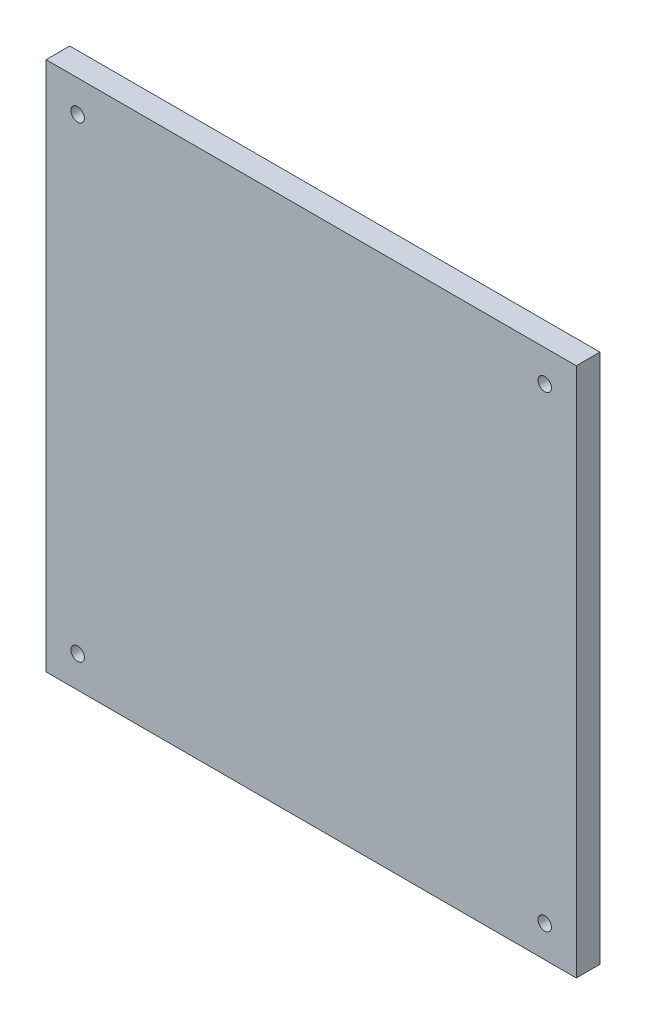
from build123d import *

# Parameters (mm, degrees)
SKETCH1_W               = 266.7
SKETCH1_H               = 266.7
BOSS_EXTRUDE1_DEPTH     = 11.90625
F_1_4_CLEARANCE_HOLE1_D = 6.7564


with BuildPart() as part:
    # Sketch1 → Boss-Extrude1 (new body)
    with BuildSketch(Plane.XY):
        Rectangle(SKETCH1_W, SKETCH1_H)
    extrude(amount=BOSS_EXTRUDE1_DEPTH)

    # 1/4 Clearance Hole1 (through all)
    with Locations(Plane.XY.offset(11.90625)):
        with Locations((-117.475, 117.475), (117.475, 117.475), (117.475, -117.475), (-117.475, -117.475)):
            Hole(F_1_4_CLEARANCE_HOLE1_D / 2)


solid = part.part
